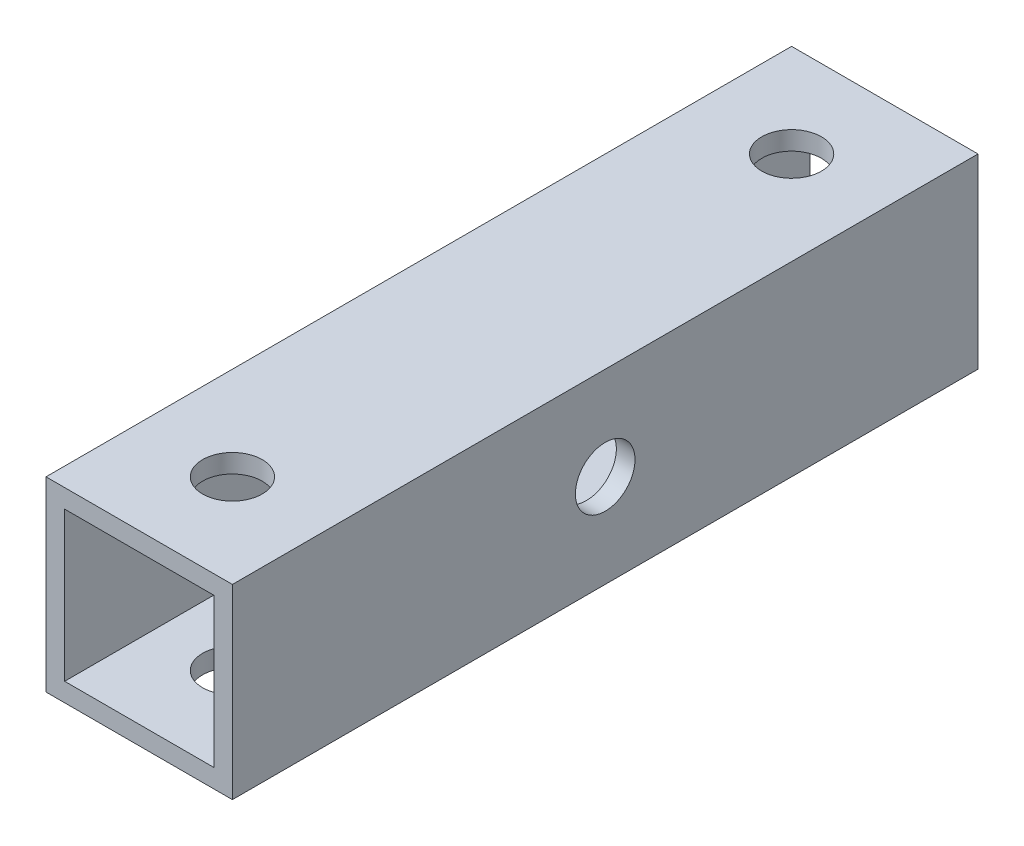
from build123d import *

# Parameters (mm, degrees)
SKETCH_1_W          = 10
SKETCH_1_H          = 10
SKETCH_1_W_2        = 8
SKETCH_1_H_2        = 8
EXTRUDE_1_DEPTH     = 40
SKETCH_2_R          = 1.6
CUT_EXTRUDE_1_DEPTH = 408.37168574
SKETCH_3_R          = 1.6
CUT_EXTRUDE_2_DEPTH = 10


with BuildPart() as part:
    # ｽｹｯﾁ1 → ﾎﾞｽ - 押し出し1 (new body)
    with BuildSketch(Plane.XY):
        Rectangle(SKETCH_1_W, SKETCH_1_H)
        Rectangle(SKETCH_1_W_2, SKETCH_1_H_2, mode=Mode.SUBTRACT)
    extrude(amount=EXTRUDE_1_DEPTH)

    # ｽｹｯﾁ2 → ｶｯﾄ - 押し出し1 (cut)
    with BuildSketch(Plane(origin=(0, 5, 0), x_dir=(1, 0, 0), z_dir=(0, 1, 0))):
        with Locations(Location((0, -5, 0), (0, 0, 270))):
            Circle(SKETCH_2_R)
        with Locations(Location((0, -35, 0), (0, 0, 270))):
            Circle(SKETCH_2_R)
    extrude(amount=-CUT_EXTRUDE_1_DEPTH, mode=Mode.SUBTRACT)

    # ｽｹｯﾁ3 → ｶｯﾄ - 押し出し2 (cut)
    with BuildSketch(Plane(origin=(5, 0, 0), x_dir=(0, 0, -1), z_dir=(1, 0, 0))):
        with Locations(Location((-20, 0, 0), (0, 0, 90))):
            Circle(SKETCH_3_R)
    extrude(amount=-CUT_EXTRUDE_2_DEPTH, mode=Mode.SUBTRACT)


solid = part.part
